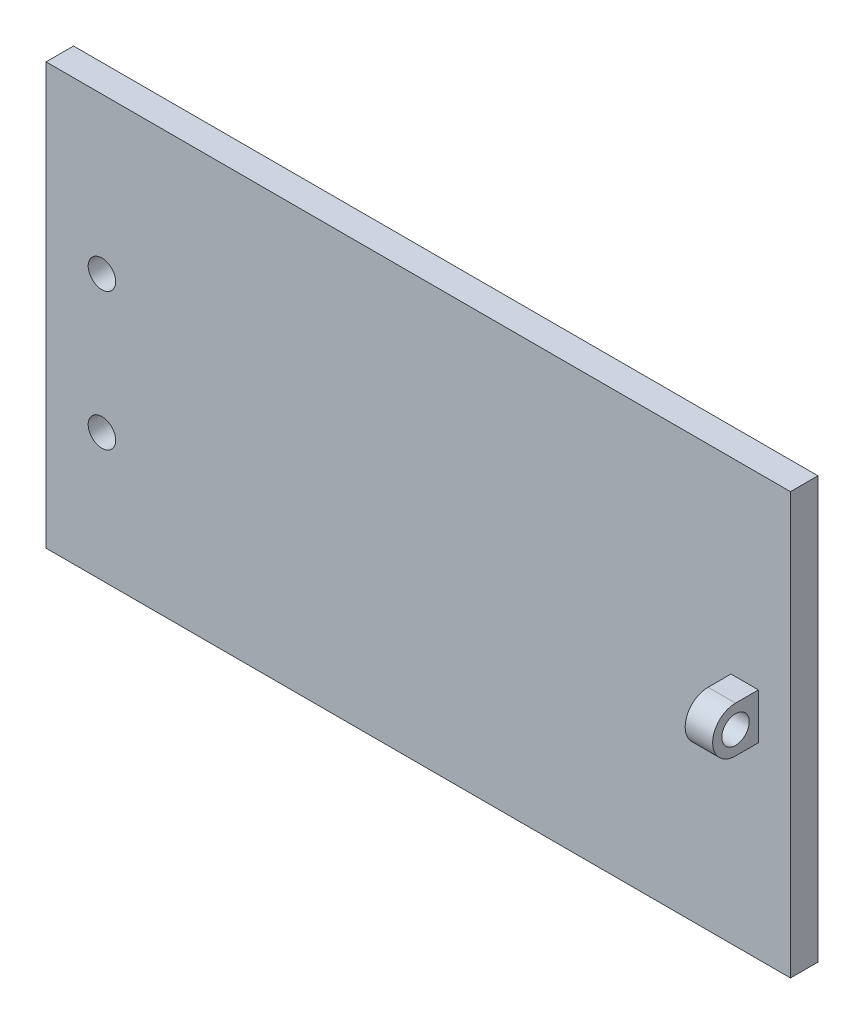
from build123d import *

# Parameters (mm, degrees)
SKETCH1_W           = 81.3
SKETCH1_H           = 46
BOSS_EXTRUDE1_DEPTH = 3
SKETCH5_W           = 3
SKETCH5_H           = 5
BOSS_EXTRUDE3_DEPTH = 5
SKETCH6_R           = 1.5
CUT_EXTRUDE2_DEPTH  = 47.972571784
FILLET5_RADIUS      = 2.5
FILLET5_LENGTH      = 3
SKETCH7_R           = 1.5
CUT_EXTRUDE3_DEPTH  = 10


with BuildPart() as part:
    # Sketch1 → Boss-Extrude1 (new body)
    with BuildSketch(Plane.XY):
        Rectangle(SKETCH1_W, SKETCH1_H)
    extrude(amount=-BOSS_EXTRUDE1_DEPTH)

    # Sketch5 → Boss-Extrude3 (add)
    with BuildSketch(Plane.XY):
        with Locations((35.65, 0)):
            Rectangle(SKETCH5_W, SKETCH5_H)
    extrude(amount=BOSS_EXTRUDE3_DEPTH)

    # Sketch6 → Cut-Extrude2 (cut, through all)
    with BuildSketch(Plane(origin=(0, 0, 0), x_dir=(0, 0, -1), z_dir=(1, 0, 0))):
        with Locations(Location((-2.5, 0, 0), (0, 0, 180))):
            Circle(SKETCH6_R)
    extrude(amount=CUT_EXTRUDE2_DEPTH, mode=Mode.SUBTRACT)

    # Fillet5: full round fillet: the end face becomes a half cylinder, R = half its width
    fillet5_face = Plane((35.65, 0, 5), x_dir=(-1, 0, 0), z_dir=(0, 0, 1))  # on the end face: x along it, z out of the body
    fillet5_slab = fillet5_face.offset(-FILLET5_RADIUS / 2) * Box(FILLET5_LENGTH, 2 * FILLET5_RADIUS, FILLET5_RADIUS, mode=Mode.PRIVATE)  # the body's end, R deep
    fillet5_round = Plane((35.65, 0, 2.5), x_dir=(0, 0, 1), z_dir=(-1, 0, 0)) * Cylinder(FILLET5_RADIUS, FILLET5_LENGTH, mode=Mode.PRIVATE)  # its axis R under the face
    add(fillet5_slab - fillet5_round, mode=Mode.SUBTRACT)

    # Sketch7 → Cut-Extrude3 (cut)
    with BuildSketch(Plane.XY):
        with Locations((-34.55, -9)):
            Circle(SKETCH7_R)
        with Locations((-34.55, 6)):
            Circle(SKETCH7_R)
    extrude(amount=-CUT_EXTRUDE3_DEPTH, mode=Mode.SUBTRACT)


solid = part.part
